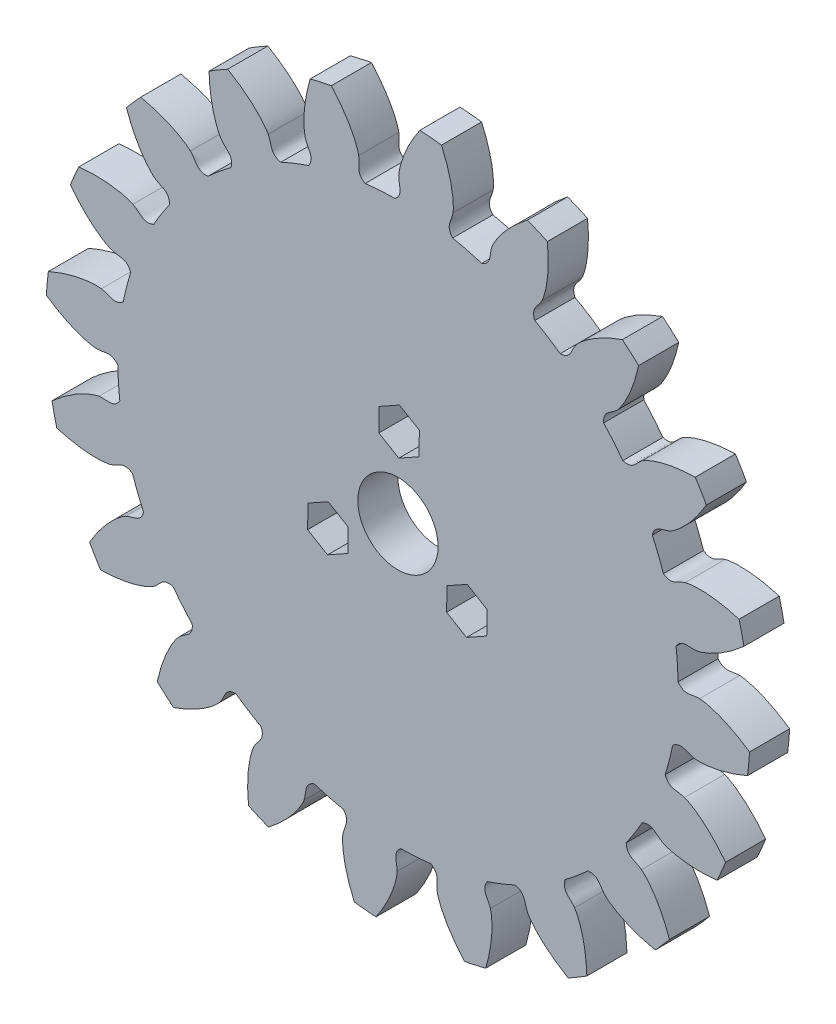
from build123d import *

# Parameters (mm, degrees)
EXTRUDE_1_DEPTH     = 5
SKETCH_4_R          = 5
CUT_EXTRUDE_1_DEPTH = 10
CUT_EXTRUDE_2_DEPTH = 30


with BuildPart() as part:
    # 草图3 → 凸台-拉伸1 (new body)
    with BuildSketch(Plane.XY):
        with BuildLine():
            ThreePointArc((-21.214390223, 38.433834658), (-22.388614953, 37.761884481), (-23.541576641, 37.054070873))
            add(Edge.make_bspline(
                [(-23.541576641, 37.054070873), (-23.510293487, 35.913117871), (-23.395194842, 34.774873193), (-23.047762199, 33.099059204), (-22.903178896, 32.548198428), (-22.628897046, 31.745215746), (-22.527778629, 31.481156662), (-22.355738569, 31.092635948), (-22.294977431, 30.964398059), (-22.163525568, 30.711612716), (-22.095368302, 30.586123676), (-22.011579578, 30.466444229)],
                knots=[0, 0, 0, 0, 0.5, 0.5, 0.75, 0.75, 0.875, 0.875, 0.9375, 0.9375, 1, 1, 1, 1], degree=3))
            add(Edge.make_bspline(
                [(-22.011579578, 30.466444229), (-21.871386265, 30.266199404), (-21.703478955, 30.091544269), (-21.355703543, 29.753277986), (-21.17540581, 29.589562165), (-20.953048582, 29.303224649), (-20.88681777, 29.199161973), (-20.787538017, 28.979202174), (-20.753612732, 28.860979271), (-20.721011052, 28.620539826), (-20.721620503, 28.499353877), (-20.747786174, 28.256747015), (-20.77422416, 28.138042918), (-20.805596249, 28.020299155)],
                knots=[0, 0, 0, 0, 0.25, 0.25, 0.5, 0.5, 0.625, 0.625, 0.75, 0.75, 0.875, 0.875, 1, 1, 1, 1], degree=3))
            ThreePointArc((-20.805596249, 28.020299155), (-22.275767015, 26.866339607), (-23.68205505, 25.635332426))
            add(Edge.make_bspline(
                [(-23.68205505, 25.635332426), (-23.923816165, 25.617383515), (-24.164783849, 25.623684882), (-24.513515182, 25.737971889), (-24.621640879, 25.791648864), (-24.821665001, 25.930148375), (-24.911422608, 26.013810336), (-25.152212173, 26.284428321), (-25.280891662, 26.493356946), (-25.549878805, 26.899462079), (-25.690836604, 27.097766645), (-25.862515312, 27.273506581)],
                knots=[0, 0, 0, 0, 0.25, 0.25, 0.375, 0.375, 0.5, 0.5, 0.75, 0.75, 1, 1, 1, 1], degree=3))
            add(Edge.make_bspline(
                [(-25.862515312, 27.273506581), (-25.963586321, 27.376968525), (-26.073835943, 27.467011005), (-26.297337789, 27.642706051), (-26.412058421, 27.726211751), (-26.762413586, 27.967674069), (-27.004186152, 28.116656661), (-27.747316911, 28.537561091), (-28.263534058, 28.781967196), (-29.316294105, 29.215192222), (-29.855285028, 29.404390106), (-30.944358277, 29.734711026), (-31.495636375, 29.876231737), (-32.052792123, 29.997141792)],
                knots=[0, 0, 0, 0, 0.0625, 0.0625, 0.125, 0.125, 0.25, 0.25, 0.5, 0.5, 0.75, 0.75, 1, 1, 1, 1], degree=3))
            ThreePointArc((-32.052792123, 29.997141792), (-32.961902182, 28.995223798), (-33.839707477, 27.965768297))
            add(Edge.make_bspline(
                [(-33.839707477, 27.965768297), (-33.457381562, 26.890324536), (-32.996179297, 25.843356957), (-32.147896216, 24.356925735), (-31.840163983, 23.877704703), (-31.331171147, 23.198780544), (-31.153403073, 22.978892742), (-30.86972375, 22.662550887), (-30.772308787, 22.559365632), (-30.569175669, 22.359573344), (-30.465576011, 22.261287928), (-30.348905217, 22.173358149)],
                knots=[0, 0, 0, 0, 0.5, 0.5, 0.75, 0.75, 0.875, 0.875, 0.9375, 0.9375, 1, 1, 1, 1], degree=3))
            add(Edge.make_bspline(
                [(-30.348905217, 22.173358149), (-30.153694398, 22.02623612), (-29.940033653, 21.912015429), (-29.504749551, 21.697773588), (-29.282685246, 21.597785653), (-28.982727796, 21.394174656), (-28.887581416, 21.315671615), (-28.725189444, 21.137156546), (-28.656391695, 21.035203373), (-28.551085779, 20.816606346), (-28.514216884, 20.701163328), (-28.464132273, 20.462344854), (-28.452594708, 20.341280763), (-28.446046514, 20.219605281)],
                knots=[0, 0, 0, 0, 0.25, 0.25, 0.5, 0.5, 0.625, 0.625, 0.75, 0.75, 0.875, 0.875, 1, 1, 1, 1], degree=3))
            ThreePointArc((-28.446046514, 20.219605281), (-29.48766889, 18.667816782), (-30.444726151, 17.062492479))
            add(Edge.make_bspline(
                [(-30.444726151, 17.062492479), (-30.669108116, 16.970713757), (-30.900229231, 16.902243604), (-31.267209065, 16.903173098), (-31.386629812, 16.920810257), (-31.619662759, 16.990720267), (-31.730880284, 17.042550894), (-32.043510325, 17.225515824), (-32.230454287, 17.384454605), (-32.61176965, 17.68756194), (-32.807107964, 17.832602434), (-33.024690745, 17.946689408)],
                knots=[0, 0, 0, 0, 0.25, 0.25, 0.375, 0.375, 0.5, 0.5, 0.75, 0.75, 1, 1, 1, 1], degree=3))
            add(Edge.make_bspline(
                [(-33.024690745, 17.946689408), (-33.152786486, 18.013854904), (-33.285464764, 18.065421384), (-33.552320405, 18.163451434), (-33.687230891, 18.20741945), (-34.095054413, 18.32879806), (-34.37103194, 18.395777093), (-35.207857913, 18.566440961), (-35.774335234, 18.639365109), (-36.909443433, 18.726065847), (-37.480519624, 18.739446372), (-38.618364612, 18.717058094), (-39.186393544, 18.681297987), (-39.75364341, 18.624119689)],
                knots=[0, 0, 0, 0, 0.0625, 0.0625, 0.125, 0.125, 0.25, 0.25, 0.5, 0.5, 0.75, 0.75, 1, 1, 1, 1], degree=3))
            ThreePointArc((-39.75364341, 18.624119689), (-40.308648769, 17.390308594), (-40.82537197, 16.139981477))
            add(Edge.make_bspline(
                [(-40.82537197, 16.139981477), (-40.129428019, 15.235318885), (-39.367267825, 14.382112885), (-38.101170165, 13.230566673), (-37.660411975, 12.869894877), (-36.96653192, 12.381487068), (-36.729515367, 12.227294697), (-36.361965289, 12.014097446), (-36.237432155, 11.946065317), (-35.982501868, 11.818823145), (-35.853600874, 11.757362214), (-35.715468559, 11.709789283)],
                knots=[0, 0, 0, 0, 0.5, 0.5, 0.75, 0.75, 0.875, 0.875, 0.9375, 0.9375, 1, 1, 1, 1], degree=3))
            add(Edge.make_bspline(
                [(-35.715468559, 11.709789283), (-35.484348831, 11.630191379), (-35.245849252, 11.587585848), (-34.765665101, 11.518339934), (-34.523571426, 11.491867401), (-34.17537568, 11.390913785), (-34.060627321, 11.345654805), (-33.851019188, 11.226058764), (-33.754083377, 11.150355209), (-33.586381304, 10.974998398), (-33.515643046, 10.87659868), (-33.394210783, 10.66494581), (-33.345827046, 10.55337232), (-33.301999552, 10.439675563)],
                knots=[0, 0, 0, 0, 0.25, 0.25, 0.5, 0.5, 0.625, 0.625, 0.75, 0.75, 0.875, 0.875, 1, 1, 1, 1], degree=3))
            ThreePointArc((-33.301999552, 10.439675563), (-33.813112282, 8.641957984), (-34.227255335, 6.819456887))
            add(Edge.make_bspline(
                [(-34.227255335, 6.819456887), (-34.41229408, 6.662832295), (-34.610944882, 6.526292957), (-34.960250674, 6.413773953), (-35.079276736, 6.393644848), (-35.322507619, 6.388122077), (-35.444298316, 6.403047828), (-35.798166427, 6.480449821), (-36.025075484, 6.573840724), (-36.481393262, 6.744280002), (-36.711991016, 6.821858851), (-36.954179351, 6.863125233)],
                knots=[0, 0, 0, 0, 0.25, 0.25, 0.375, 0.375, 0.5, 0.5, 0.75, 0.75, 1, 1, 1, 1], degree=3))
            add(Edge.make_bspline(
                [(-36.954179351, 6.863125233), (-37.09676092, 6.887419655), (-37.23888038, 6.895462449), (-37.522968128, 6.906231639), (-37.664862488, 6.906358074), (-38.09023376, 6.895771593), (-38.373401645, 6.874190693), (-39.222008475, 6.77790823), (-39.783295224, 6.672212096), (-40.889639274, 6.403901675), (-41.436899816, 6.240155062), (-42.512136348, 5.867249106), (-43.041313485, 5.65770863), (-43.563131101, 5.428038988)],
                knots=[0, 0, 0, 0, 0.0625, 0.0625, 0.125, 0.125, 0.25, 0.25, 0.5, 0.5, 0.75, 0.75, 1, 1, 1, 1], degree=3))
            ThreePointArc((-43.563131101, 5.428038988), (-43.709703968, 4.083108819), (-43.814764607, 2.734300816))
            add(Edge.make_bspline(
                [(-43.814764607, 2.734300816), (-42.873326463, 2.088974071), (-41.88481389, 1.513047397), (-40.324836111, 0.809107562), (-39.794196448, 0.602290072), (-38.983350987, 0.352207371), (-38.710286786, 0.278803855), (-38.294844316, 0.189620441), (-38.155383184, 0.163400895), (-37.87361008, 0.121164189), (-37.732025477, 0.102543968), (-37.585952995, 0.099984656)],
                knots=[0, 0, 0, 0, 0.5, 0.5, 0.75, 0.75, 0.875, 0.875, 0.9375, 0.9375, 1, 1, 1, 1], degree=3))
            add(Edge.make_bspline(
                [(-37.585952995, 0.099984656), (-37.341547966, 0.095702474), (-37.101555554, 0.128882629), (-36.623475124, 0.211410915), (-36.385049894, 0.261045099), (-36.022699678, 0.272630907), (-35.89958171, 0.265046253), (-35.66327532, 0.216076134), (-35.5476902, 0.174032587), (-35.334007816, 0.059081141), (-35.23632455, -0.012643229), (-35.055431271, -0.176412437), (-34.974937498, -0.267573734), (-34.898120844, -0.362162336)],
                knots=[0, 0, 0, 0, 0.25, 0.25, 0.5, 0.5, 0.625, 0.625, 0.75, 0.75, 0.875, 0.875, 1, 1, 1, 1], degree=3))
            ThreePointArc((-34.898120844, -0.362162336), (-34.828692654, -2.229835874), (-34.659382292, -4.09111466))
            add(Edge.make_bspline(
                [(-34.659382292, -4.09111466), (-34.786964935, -4.297253615), (-34.933700099, -4.488496716), (-35.231139364, -4.703450074), (-35.33811964, -4.759375066), (-35.567739327, -4.83979001), (-35.688181473, -4.863230172), (-36.048648577, -4.898967762), (-36.293311291, -4.880266491), (-36.779963921, -4.859179053), (-37.0232486, -4.856655808), (-37.266335408, -4.892249458)],
                knots=[0, 0, 0, 0, 0.25, 0.25, 0.375, 0.375, 0.5, 0.5, 0.75, 0.75, 1, 1, 1, 1], degree=3))
            add(Edge.make_bspline(
                [(-37.266335408, -4.892249458), (-37.409445927, -4.913204218), (-37.547094925, -4.949472393), (-37.820606293, -5.027018228), (-37.955594919, -5.07074575), (-38.356875637, -5.212261043), (-38.619515434, -5.320289387), (-39.396835571, -5.674093384), (-39.89798909, -5.948063524), (-40.867272328, -6.545121012), (-41.337147547, -6.869966103), (-42.24452398, -7.556887104), (-42.683049776, -7.919696667), (-43.108355997, -8.299375988)],
                knots=[0, 0, 0, 0, 0.0625, 0.0625, 0.125, 0.125, 0.25, 0.25, 0.5, 0.5, 0.75, 0.75, 1, 1, 1, 1], degree=3))
            ThreePointArc((-43.108355997, -8.299375988), (-42.832148799, -9.623774096), (-42.51526281, -10.93903226))
            add(Edge.make_bspline(
                [(-42.51526281, -10.93903226), (-41.420484996, -11.261854079), (-40.302382543, -11.504125712), (-38.601226139, -11.691552634), (-38.032647711, -11.724271083), (-37.184208046, -11.711548837), (-36.901825625, -11.696978251), (-36.479157166, -11.653417935), (-36.338419462, -11.635258345), (-36.057385455, -11.588355161), (-35.916976532, -11.562311995), (-35.777262475, -11.519607167)],
                knots=[0, 0, 0, 0, 0.5, 0.5, 0.75, 0.75, 0.875, 0.875, 0.9375, 0.9375, 1, 1, 1, 1], degree=3))
            add(Edge.make_bspline(
                [(-35.777262475, -11.519607167), (-35.543496213, -11.448154457), (-35.325503097, -11.34243652), (-34.896324232, -11.116212478), (-34.68490617, -10.995330116), (-34.343870847, -10.872338983), (-34.224434914, -10.841506874), (-33.984561583, -10.815057534), (-33.861641431, -10.819325557), (-33.622895457, -10.862619391), (-33.507829101, -10.900647531), (-33.285181901, -11.000502206), (-33.180457384, -11.062327808), (-33.078170919, -11.128549262)],
                knots=[0, 0, 0, 0, 0.25, 0.25, 0.5, 0.5, 0.625, 0.625, 0.75, 0.75, 0.875, 0.875, 1, 1, 1, 1], degree=3))
            ThreePointArc((-33.078170919, -11.128549262), (-32.434997923, -12.88335786), (-31.698807423, -14.601219399))
            add(Edge.make_bspline(
                [(-31.698807423, -14.601219399), (-31.756445288, -14.8366944), (-31.836901353, -15.063921057), (-32.053358664, -15.360267637), (-32.13782118, -15.446514188), (-32.331352894, -15.59394973), (-32.438656774, -15.653461319), (-32.77043784, -15.798840248), (-33.008904918, -15.856659218), (-33.47825545, -15.986987806), (-33.710412655, -16.059767158), (-33.930602905, -16.168736685)],
                knots=[0, 0, 0, 0, 0.25, 0.25, 0.375, 0.375, 0.5, 0.5, 0.75, 0.75, 1, 1, 1, 1], degree=3))
            add(Edge.make_bspline(
                [(-33.930602905, -16.168736685), (-34.06023372, -16.232889429), (-34.179938214, -16.309918393), (-34.416100001, -16.468188525), (-34.530969267, -16.551489649), (-34.868879278, -16.810081253), (-35.085281974, -16.993982474), (-35.715225908, -17.570675203), (-36.107189799, -17.986101244), (-36.844532028, -18.853461652), (-37.191027263, -19.30760712), (-37.841723269, -20.241302552), (-38.146671764, -20.721866874), (-38.433834655, -21.214390217)],
                knots=[0, 0, 0, 0, 0.0625, 0.0625, 0.125, 0.125, 0.25, 0.25, 0.5, 0.5, 0.75, 0.75, 1, 1, 1, 1], degree=3))
            ThreePointArc((-38.433834655, -21.214390217), (-37.761884476, -22.38861495), (-37.054070867, -23.541576641))
            add(Edge.make_bspline(
                [(-37.054070867, -23.541576641), (-35.913117865, -23.510293487), (-34.774873189, -23.395194842), (-33.099059202, -23.047762199), (-32.548198426, -22.903178896), (-31.745215744, -22.628897046), (-31.481156661, -22.527778629), (-31.092635947, -22.355738569), (-30.964398059, -22.29497743), (-30.711612716, -22.163525568), (-30.586123676, -22.095368302), (-30.466444229, -22.011579578)],
                knots=[0, 0, 0, 0, 0.5, 0.5, 0.75, 0.75, 0.875, 0.875, 0.9375, 0.9375, 1, 1, 1, 1], degree=3))
            add(Edge.make_bspline(
                [(-30.466444229, -22.011579578), (-30.266199404, -21.871386265), (-30.091544269, -21.703478955), (-29.753277986, -21.355703543), (-29.589562165, -21.17540581), (-29.303224649, -20.953048582), (-29.199161973, -20.88681777), (-28.979202174, -20.787538017), (-28.860979271, -20.753612732), (-28.620539826, -20.721011052), (-28.499353877, -20.721620503), (-28.256747015, -20.747786174), (-28.138042918, -20.77422416), (-28.020299155, -20.805596249)],
                knots=[0, 0, 0, 0, 0.25, 0.25, 0.5, 0.5, 0.625, 0.625, 0.75, 0.75, 0.875, 0.875, 1, 1, 1, 1], degree=3))
            ThreePointArc((-28.020299155, -20.805596249), (-26.866339607, -22.275767015), (-25.635332426, -23.68205505))
            add(Edge.make_bspline(
                [(-25.635332426, -23.68205505), (-25.617383515, -23.923816165), (-25.623684882, -24.164783849), (-25.737971889, -24.513515182), (-25.791648864, -24.621640879), (-25.930148375, -24.821665001), (-26.013810336, -24.911422608), (-26.284428321, -25.152212173), (-26.493356946, -25.280891662), (-26.899462079, -25.549878805), (-27.097766645, -25.690836604), (-27.273506581, -25.862515312)],
                knots=[0, 0, 0, 0, 0.25, 0.25, 0.375, 0.375, 0.5, 0.5, 0.75, 0.75, 1, 1, 1, 1], degree=3))
            add(Edge.make_bspline(
                [(-27.273506581, -25.862515312), (-27.376968525, -25.963586321), (-27.467011005, -26.073835943), (-27.642706051, -26.297337789), (-27.726211751, -26.412058421), (-27.967674069, -26.762413586), (-28.116656661, -27.004186152), (-28.537561091, -27.747316911), (-28.781967196, -28.263534058), (-29.215192222, -29.316294105), (-29.404390106, -29.855285028), (-29.734711026, -30.944358277), (-29.876231737, -31.495636375), (-29.997141792, -32.052792123)],
                knots=[0, 0, 0, 0, 0.0625, 0.0625, 0.125, 0.125, 0.25, 0.25, 0.5, 0.5, 0.75, 0.75, 1, 1, 1, 1], degree=3))
            ThreePointArc((-29.997141792, -32.052792123), (-28.995223798, -32.961902182), (-27.965768297, -33.839707477))
            add(Edge.make_bspline(
                [(-27.965768297, -33.839707477), (-26.890324536, -33.457381562), (-25.843356957, -32.996179297), (-24.356925735, -32.147896216), (-23.877704703, -31.840163983), (-23.198780544, -31.331171147), (-22.978892742, -31.153403073), (-22.662550887, -30.86972375), (-22.559365632, -30.772308787), (-22.359573344, -30.569175669), (-22.261287928, -30.465576011), (-22.173358149, -30.348905217)],
                knots=[0, 0, 0, 0, 0.5, 0.5, 0.75, 0.75, 0.875, 0.875, 0.9375, 0.9375, 1, 1, 1, 1], degree=3))
            add(Edge.make_bspline(
                [(-22.173358149, -30.348905217), (-22.02623612, -30.153694398), (-21.912015429, -29.940033653), (-21.697773588, -29.504749551), (-21.597785653, -29.282685246), (-21.394174656, -28.982727796), (-21.315671615, -28.887581416), (-21.137156546, -28.725189444), (-21.035203373, -28.656391695), (-20.816606346, -28.551085779), (-20.701163328, -28.514216884), (-20.462344854, -28.464132273), (-20.341280763, -28.452594708), (-20.219605281, -28.446046514)],
                knots=[0, 0, 0, 0, 0.25, 0.25, 0.5, 0.5, 0.625, 0.625, 0.75, 0.75, 0.875, 0.875, 1, 1, 1, 1], degree=3))
            ThreePointArc((-20.219605281, -28.446046514), (-18.667816782, -29.48766889), (-17.062492479, -30.444726151))
            add(Edge.make_bspline(
                [(-17.062492479, -30.444726151), (-16.970713757, -30.669108116), (-16.902243604, -30.900229231), (-16.903173098, -31.267209065), (-16.920810257, -31.386629812), (-16.990720267, -31.619662759), (-17.042550894, -31.730880284), (-17.225515824, -32.043510325), (-17.384454605, -32.230454287), (-17.68756194, -32.61176965), (-17.832602434, -32.807107964), (-17.946689408, -33.024690745)],
                knots=[0, 0, 0, 0, 0.25, 0.25, 0.375, 0.375, 0.5, 0.5, 0.75, 0.75, 1, 1, 1, 1], degree=3))
            add(Edge.make_bspline(
                [(-17.946689408, -33.024690745), (-18.013854904, -33.152786486), (-18.065421384, -33.285464764), (-18.163451434, -33.552320405), (-18.20741945, -33.687230891), (-18.32879806, -34.095054413), (-18.395777093, -34.37103194), (-18.566440961, -35.207857913), (-18.639365109, -35.774335234), (-18.726065847, -36.909443433), (-18.739446372, -37.480519624), (-18.717058094, -38.618364612), (-18.681297987, -39.186393544), (-18.624119689, -39.75364341)],
                knots=[0, 0, 0, 0, 0.0625, 0.0625, 0.125, 0.125, 0.25, 0.25, 0.5, 0.5, 0.75, 0.75, 1, 1, 1, 1], degree=3))
            ThreePointArc((-18.624119689, -39.75364341), (-17.390308594, -40.308648769), (-16.139981477, -40.82537197))
            add(Edge.make_bspline(
                [(-16.139981477, -40.82537197), (-15.235318885, -40.129428019), (-14.382112885, -39.367267825), (-13.230566673, -38.101170165), (-12.869894877, -37.660411975), (-12.381487068, -36.96653192), (-12.227294697, -36.729515367), (-12.014097446, -36.361965289), (-11.946065317, -36.237432155), (-11.818823145, -35.982501868), (-11.757362214, -35.853600874), (-11.709789283, -35.715468559)],
                knots=[0, 0, 0, 0, 0.5, 0.5, 0.75, 0.75, 0.875, 0.875, 0.9375, 0.9375, 1, 1, 1, 1], degree=3))
            add(Edge.make_bspline(
                [(-11.709789283, -35.715468559), (-11.630191379, -35.484348831), (-11.587585848, -35.245849252), (-11.518339934, -34.765665101), (-11.491867401, -34.523571426), (-11.390913785, -34.17537568), (-11.345654805, -34.060627321), (-11.226058764, -33.851019188), (-11.150355209, -33.754083377), (-10.974998398, -33.586381304), (-10.87659868, -33.515643046), (-10.66494581, -33.394210783), (-10.55337232, -33.345827046), (-10.439675563, -33.301999552)],
                knots=[0, 0, 0, 0, 0.25, 0.25, 0.5, 0.5, 0.625, 0.625, 0.75, 0.75, 0.875, 0.875, 1, 1, 1, 1], degree=3))
            ThreePointArc((-10.439675563, -33.301999552), (-8.641957984, -33.813112282), (-6.819456887, -34.227255335))
            add(Edge.make_bspline(
                [(-6.819456887, -34.227255335), (-6.662832295, -34.41229408), (-6.526292957, -34.610944882), (-6.413773953, -34.960250674), (-6.393644848, -35.079276736), (-6.388122077, -35.322507619), (-6.403047828, -35.444298316), (-6.480449821, -35.798166427), (-6.573840724, -36.025075484), (-6.744280002, -36.481393262), (-6.821858851, -36.711991016), (-6.863125233, -36.954179351)],
                knots=[0, 0, 0, 0, 0.25, 0.25, 0.375, 0.375, 0.5, 0.5, 0.75, 0.75, 1, 1, 1, 1], degree=3))
            add(Edge.make_bspline(
                [(-6.863125233, -36.954179351), (-6.887419655, -37.09676092), (-6.895462449, -37.23888038), (-6.906231639, -37.522968128), (-6.906358074, -37.664862488), (-6.895771593, -38.09023376), (-6.874190693, -38.373401645), (-6.77790823, -39.222008475), (-6.672212096, -39.783295224), (-6.403901675, -40.889639274), (-6.240155062, -41.436899816), (-5.867249106, -42.512136348), (-5.65770863, -43.041313485), (-5.428038988, -43.563131101)],
                knots=[0, 0, 0, 0, 0.0625, 0.0625, 0.125, 0.125, 0.25, 0.25, 0.5, 0.5, 0.75, 0.75, 1, 1, 1, 1], degree=3))
            ThreePointArc((-5.428038988, -43.563131101), (-4.083108819, -43.709703968), (-2.734300816, -43.814764607))
            add(Edge.make_bspline(
                [(-2.734300816, -43.814764607), (-2.088974071, -42.873326463), (-1.513047397, -41.88481389), (-0.809107562, -40.324836111), (-0.602290072, -39.794196448), (-0.352207371, -38.983350987), (-0.278803855, -38.710286786), (-0.189620441, -38.294844316), (-0.163400895, -38.155383184), (-0.121164189, -37.87361008), (-0.102543968, -37.732025477), (-0.099984656, -37.585952995)],
                knots=[0, 0, 0, 0, 0.5, 0.5, 0.75, 0.75, 0.875, 0.875, 0.9375, 0.9375, 1, 1, 1, 1], degree=3))
            add(Edge.make_bspline(
                [(-0.099984656, -37.585952995), (-0.095702474, -37.341547966), (-0.128882629, -37.101555554), (-0.211410915, -36.623475124), (-0.261045099, -36.385049894), (-0.272630907, -36.022699678), (-0.265046253, -35.89958171), (-0.216076134, -35.66327532), (-0.174032587, -35.5476902), (-0.059081141, -35.334007816), (0.012643229, -35.23632455), (0.176412437, -35.055431271), (0.267573735, -34.974937498), (0.362162336, -34.898120844)],
                knots=[0, 0, 0, 0, 0.25, 0.25, 0.5, 0.5, 0.625, 0.625, 0.75, 0.75, 0.875, 0.875, 1, 1, 1, 1], degree=3))
            ThreePointArc((0.362162336, -34.898120844), (2.229835874, -34.828692654), (4.09111466, -34.659382292))
            add(Edge.make_bspline(
                [(4.09111466, -34.659382292), (4.297253615, -34.786964935), (4.488496716, -34.933700099), (4.703450074, -35.231139364), (4.759375066, -35.33811964), (4.83979001, -35.567739327), (4.863230172, -35.688181473), (4.898967762, -36.048648577), (4.880266491, -36.293311291), (4.859179053, -36.779963921), (4.856655808, -37.0232486), (4.892249458, -37.266335408)],
                knots=[0, 0, 0, 0, 0.25, 0.25, 0.375, 0.375, 0.5, 0.5, 0.75, 0.75, 1, 1, 1, 1], degree=3))
            add(Edge.make_bspline(
                [(4.892249458, -37.266335408), (4.913204218, -37.409445927), (4.949472393, -37.547094925), (5.027018228, -37.820606293), (5.07074575, -37.955594919), (5.212261043, -38.356875637), (5.320289387, -38.619515434), (5.674093384, -39.396835571), (5.948063524, -39.89798909), (6.545121012, -40.867272328), (6.869966103, -41.337147547), (7.556887104, -42.24452398), (7.919696667, -42.683049776), (8.299375988, -43.108355997)],
                knots=[0, 0, 0, 0, 0.0625, 0.0625, 0.125, 0.125, 0.25, 0.25, 0.5, 0.5, 0.75, 0.75, 1, 1, 1, 1], degree=3))
            ThreePointArc((8.299375988, -43.108355997), (9.623774096, -42.832148799), (10.93903226, -42.51526281))
            add(Edge.make_bspline(
                [(10.93903226, -42.51526281), (11.261854079, -41.420484996), (11.504125712, -40.302382543), (11.691552634, -38.601226139), (11.724271083, -38.032647711), (11.711548837, -37.184208046), (11.696978251, -36.901825625), (11.653417935, -36.479157166), (11.635258345, -36.338419462), (11.588355161, -36.057385455), (11.562311995, -35.916976532), (11.519607167, -35.777262475)],
                knots=[0, 0, 0, 0, 0.5, 0.5, 0.75, 0.75, 0.875, 0.875, 0.9375, 0.9375, 1, 1, 1, 1], degree=3))
            add(Edge.make_bspline(
                [(11.519607167, -35.777262475), (11.448154457, -35.543496213), (11.34243652, -35.325503097), (11.116212478, -34.896324232), (10.995330116, -34.68490617), (10.872338983, -34.343870847), (10.841506874, -34.224434914), (10.815057534, -33.984561583), (10.819325557, -33.861641431), (10.862619391, -33.622895457), (10.900647531, -33.507829101), (11.000502206, -33.285181901), (11.062327808, -33.180457384), (11.128549262, -33.078170919)],
                knots=[0, 0, 0, 0, 0.25, 0.25, 0.5, 0.5, 0.625, 0.625, 0.75, 0.75, 0.875, 0.875, 1, 1, 1, 1], degree=3))
            ThreePointArc((11.128549262, -33.078170919), (12.88335786, -32.434997923), (14.601219399, -31.698807423))
            add(Edge.make_bspline(
                [(14.601219399, -31.698807423), (14.8366944, -31.756445288), (15.063921057, -31.836901353), (15.360267637, -32.053358664), (15.446514188, -32.13782118), (15.59394973, -32.331352894), (15.653461319, -32.438656774), (15.798840248, -32.77043784), (15.856659218, -33.008904918), (15.986987806, -33.47825545), (16.059767158, -33.710412655), (16.168736685, -33.930602905)],
                knots=[0, 0, 0, 0, 0.25, 0.25, 0.375, 0.375, 0.5, 0.5, 0.75, 0.75, 1, 1, 1, 1], degree=3))
            add(Edge.make_bspline(
                [(16.168736685, -33.930602905), (16.232889429, -34.06023372), (16.309918393, -34.179938214), (16.468188525, -34.416100001), (16.551489649, -34.530969267), (16.810081253, -34.868879278), (16.993982474, -35.085281974), (17.570675203, -35.715225908), (17.986101244, -36.107189799), (18.853461652, -36.844532028), (19.30760712, -37.191027263), (20.241302552, -37.841723269), (20.721866874, -38.146671764), (21.214390217, -38.433834655)],
                knots=[0, 0, 0, 0, 0.0625, 0.0625, 0.125, 0.125, 0.25, 0.25, 0.5, 0.5, 0.75, 0.75, 1, 1, 1, 1], degree=3))
            ThreePointArc((21.214390217, -38.433834655), (22.38861495, -37.761884476), (23.541576641, -37.054070867))
            add(Edge.make_bspline(
                [(23.541576641, -37.054070867), (23.510293487, -35.913117865), (23.395194842, -34.774873189), (23.047762199, -33.099059202), (22.903178896, -32.548198426), (22.628897046, -31.745215744), (22.527778629, -31.481156661), (22.355738569, -31.092635947), (22.29497743, -30.964398059), (22.163525568, -30.711612716), (22.095368302, -30.586123676), (22.011579578, -30.466444229)],
                knots=[0, 0, 0, 0, 0.5, 0.5, 0.75, 0.75, 0.875, 0.875, 0.9375, 0.9375, 1, 1, 1, 1], degree=3))
            add(Edge.make_bspline(
                [(22.011579578, -30.466444229), (21.871386265, -30.266199404), (21.703478955, -30.091544269), (21.355703543, -29.753277986), (21.17540581, -29.589562165), (20.953048582, -29.303224649), (20.88681777, -29.199161973), (20.787538017, -28.979202174), (20.753612732, -28.860979271), (20.721011052, -28.620539826), (20.721620503, -28.499353877), (20.747786174, -28.256747015), (20.77422416, -28.138042918), (20.805596249, -28.020299155)],
                knots=[0, 0, 0, 0, 0.25, 0.25, 0.5, 0.5, 0.625, 0.625, 0.75, 0.75, 0.875, 0.875, 1, 1, 1, 1], degree=3))
            ThreePointArc((20.805596249, -28.020299155), (22.275767015, -26.866339607), (23.68205505, -25.635332426))
            add(Edge.make_bspline(
                [(23.68205505, -25.635332426), (23.923816165, -25.617383515), (24.164783849, -25.623684882), (24.513515182, -25.737971889), (24.621640879, -25.791648864), (24.821665001, -25.930148375), (24.911422608, -26.013810336), (25.152212173, -26.284428321), (25.280891662, -26.493356946), (25.549878805, -26.899462079), (25.690836604, -27.097766645), (25.862515312, -27.273506581)],
                knots=[0, 0, 0, 0, 0.25, 0.25, 0.375, 0.375, 0.5, 0.5, 0.75, 0.75, 1, 1, 1, 1], degree=3))
            add(Edge.make_bspline(
                [(25.862515312, -27.273506581), (25.963586321, -27.376968525), (26.073835943, -27.467011005), (26.297337789, -27.642706051), (26.412058421, -27.726211751), (26.762413586, -27.967674069), (27.004186152, -28.116656661), (27.747316911, -28.537561091), (28.263534058, -28.781967196), (29.316294105, -29.215192222), (29.855285028, -29.404390106), (30.944358277, -29.734711026), (31.495636375, -29.876231737), (32.052792123, -29.997141792)],
                knots=[0, 0, 0, 0, 0.0625, 0.0625, 0.125, 0.125, 0.25, 0.25, 0.5, 0.5, 0.75, 0.75, 1, 1, 1, 1], degree=3))
            ThreePointArc((32.052792123, -29.997141792), (32.961902182, -28.995223798), (33.839707477, -27.965768297))
            add(Edge.make_bspline(
                [(33.839707477, -27.965768297), (33.457381562, -26.890324536), (32.996179297, -25.843356957), (32.147896216, -24.356925735), (31.840163983, -23.877704703), (31.331171147, -23.198780544), (31.153403073, -22.978892742), (30.86972375, -22.662550887), (30.772308787, -22.559365632), (30.569175669, -22.359573344), (30.465576011, -22.261287928), (30.348905217, -22.173358149)],
                knots=[0, 0, 0, 0, 0.5, 0.5, 0.75, 0.75, 0.875, 0.875, 0.9375, 0.9375, 1, 1, 1, 1], degree=3))
            add(Edge.make_bspline(
                [(30.348905217, -22.173358149), (30.153694398, -22.02623612), (29.940033653, -21.912015429), (29.504749551, -21.697773588), (29.282685246, -21.597785653), (28.982727796, -21.394174656), (28.887581416, -21.315671615), (28.725189444, -21.137156546), (28.656391695, -21.035203373), (28.551085779, -20.816606346), (28.514216884, -20.701163328), (28.464132273, -20.462344854), (28.452594708, -20.341280763), (28.446046514, -20.219605281)],
                knots=[0, 0, 0, 0, 0.25, 0.25, 0.5, 0.5, 0.625, 0.625, 0.75, 0.75, 0.875, 0.875, 1, 1, 1, 1], degree=3))
            ThreePointArc((28.446046514, -20.219605281), (29.48766889, -18.667816782), (30.444726151, -17.062492479))
            add(Edge.make_bspline(
                [(30.444726151, -17.062492479), (30.669108116, -16.970713757), (30.900229231, -16.902243604), (31.267209065, -16.903173098), (31.386629812, -16.920810257), (31.619662759, -16.990720267), (31.730880284, -17.042550894), (32.043510325, -17.225515824), (32.230454287, -17.384454605), (32.61176965, -17.68756194), (32.807107964, -17.832602434), (33.024690745, -17.946689408)],
                knots=[0, 0, 0, 0, 0.25, 0.25, 0.375, 0.375, 0.5, 0.5, 0.75, 0.75, 1, 1, 1, 1], degree=3))
            add(Edge.make_bspline(
                [(33.024690745, -17.946689408), (33.152786486, -18.013854904), (33.285464764, -18.065421384), (33.552320405, -18.163451434), (33.687230891, -18.20741945), (34.095054413, -18.32879806), (34.37103194, -18.395777093), (35.207857913, -18.566440961), (35.774335234, -18.639365109), (36.909443433, -18.726065847), (37.480519624, -18.739446372), (38.618364612, -18.717058094), (39.186393544, -18.681297987), (39.75364341, -18.624119689)],
                knots=[0, 0, 0, 0, 0.0625, 0.0625, 0.125, 0.125, 0.25, 0.25, 0.5, 0.5, 0.75, 0.75, 1, 1, 1, 1], degree=3))
            ThreePointArc((39.75364341, -18.624119689), (40.308648769, -17.390308594), (40.82537197, -16.139981477))
            add(Edge.make_bspline(
                [(40.82537197, -16.139981477), (40.129428019, -15.235318885), (39.367267825, -14.382112885), (38.101170165, -13.230566673), (37.660411975, -12.869894877), (36.96653192, -12.381487068), (36.729515367, -12.227294697), (36.361965289, -12.014097446), (36.237432155, -11.946065317), (35.982501868, -11.818823145), (35.853600874, -11.757362214), (35.715468559, -11.709789283)],
                knots=[0, 0, 0, 0, 0.5, 0.5, 0.75, 0.75, 0.875, 0.875, 0.9375, 0.9375, 1, 1, 1, 1], degree=3))
            add(Edge.make_bspline(
                [(35.715468559, -11.709789283), (35.484348831, -11.630191379), (35.245849252, -11.587585848), (34.765665101, -11.518339934), (34.523571426, -11.491867401), (34.17537568, -11.390913784), (34.060627321, -11.345654805), (33.851019188, -11.226058764), (33.754083377, -11.150355209), (33.586381304, -10.974998398), (33.515643046, -10.87659868), (33.394210783, -10.66494581), (33.345827046, -10.55337232), (33.301999552, -10.439675563)],
                knots=[0, 0, 0, 0, 0.25, 0.25, 0.5, 0.5, 0.625, 0.625, 0.75, 0.75, 0.875, 0.875, 1, 1, 1, 1], degree=3))
            ThreePointArc((33.301999552, -10.439675563), (33.813112282, -8.641957984), (34.227255335, -6.819456887))
            add(Edge.make_bspline(
                [(34.227255335, -6.819456887), (34.41229408, -6.662832295), (34.610944882, -6.526292957), (34.960250674, -6.413773953), (35.079276736, -6.393644848), (35.322507619, -6.388122077), (35.444298316, -6.403047828), (35.798166427, -6.480449821), (36.025075484, -6.573840724), (36.481393262, -6.744280002), (36.711991016, -6.821858851), (36.954179351, -6.863125233)],
                knots=[0, 0, 0, 0, 0.25, 0.25, 0.375, 0.375, 0.5, 0.5, 0.75, 0.75, 1, 1, 1, 1], degree=3))
            add(Edge.make_bspline(
                [(36.954179351, -6.863125233), (37.09676092, -6.887419655), (37.23888038, -6.895462449), (37.522968128, -6.906231639), (37.664862488, -6.906358074), (38.09023376, -6.895771593), (38.373401645, -6.874190693), (39.222008475, -6.77790823), (39.783295224, -6.672212096), (40.889639274, -6.403901675), (41.436899816, -6.240155062), (42.512136348, -5.867249106), (43.041313485, -5.65770863), (43.563131101, -5.428038988)],
                knots=[0, 0, 0, 0, 0.0625, 0.0625, 0.125, 0.125, 0.25, 0.25, 0.5, 0.5, 0.75, 0.75, 1, 1, 1, 1], degree=3))
            ThreePointArc((43.563131101, -5.428038988), (43.709703968, -4.083108819), (43.814764607, -2.734300816))
            add(Edge.make_bspline(
                [(43.814764607, -2.734300816), (42.873326463, -2.088974071), (41.88481389, -1.513047397), (40.324836111, -0.809107562), (39.794196448, -0.602290072), (38.983350987, -0.352207371), (38.710286786, -0.278803855), (38.294844316, -0.189620441), (38.155383184, -0.163400895), (37.87361008, -0.121164189), (37.732025477, -0.102543968), (37.585952995, -0.099984656)],
                knots=[0, 0, 0, 0, 0.5, 0.5, 0.75, 0.75, 0.875, 0.875, 0.9375, 0.9375, 1, 1, 1, 1], degree=3))
            add(Edge.make_bspline(
                [(37.585952995, -0.099984656), (37.341547966, -0.095702474), (37.101555554, -0.128882629), (36.623475124, -0.211410915), (36.385049894, -0.261045099), (36.022699678, -0.272630907), (35.89958171, -0.265046253), (35.66327532, -0.216076134), (35.5476902, -0.174032587), (35.334007816, -0.059081141), (35.23632455, 0.012643229), (35.055431271, 0.176412437), (34.974937498, 0.267573735), (34.898120844, 0.362162336)],
                knots=[0, 0, 0, 0, 0.25, 0.25, 0.5, 0.5, 0.625, 0.625, 0.75, 0.75, 0.875, 0.875, 1, 1, 1, 1], degree=3))
            ThreePointArc((34.898120844, 0.362162336), (34.828692654, 2.229835874), (34.659382292, 4.09111466))
            add(Edge.make_bspline(
                [(34.659382292, 4.09111466), (34.786964935, 4.297253615), (34.933700099, 4.488496716), (35.231139364, 4.703450074), (35.33811964, 4.759375066), (35.567739327, 4.83979001), (35.688181473, 4.863230172), (36.048648577, 4.898967762), (36.293311291, 4.880266491), (36.779963921, 4.859179053), (37.0232486, 4.856655808), (37.266335408, 4.892249458)],
                knots=[0, 0, 0, 0, 0.25, 0.25, 0.375, 0.375, 0.5, 0.5, 0.75, 0.75, 1, 1, 1, 1], degree=3))
            add(Edge.make_bspline(
                [(37.266335408, 4.892249458), (37.409445927, 4.913204218), (37.547094925, 4.949472393), (37.820606293, 5.027018228), (37.955594919, 5.07074575), (38.356875637, 5.212261043), (38.619515434, 5.320289387), (39.396835571, 5.674093384), (39.89798909, 5.948063524), (40.867272328, 6.545121012), (41.337147547, 6.869966103), (42.24452398, 7.556887104), (42.683049776, 7.919696667), (43.108355997, 8.299375988)],
                knots=[0, 0, 0, 0, 0.0625, 0.0625, 0.125, 0.125, 0.25, 0.25, 0.5, 0.5, 0.75, 0.75, 1, 1, 1, 1], degree=3))
            ThreePointArc((43.108355997, 8.299375988), (42.832148799, 9.623774096), (42.51526281, 10.93903226))
            add(Edge.make_bspline(
                [(42.51526281, 10.93903226), (41.420484996, 11.261854079), (40.302382543, 11.504125712), (38.601226139, 11.691552634), (38.032647711, 11.724271083), (37.184208046, 11.711548837), (36.901825625, 11.696978251), (36.479157166, 11.653417935), (36.338419462, 11.635258345), (36.057385455, 11.588355161), (35.916976532, 11.562311995), (35.777262475, 11.519607167)],
                knots=[0, 0, 0, 0, 0.5, 0.5, 0.75, 0.75, 0.875, 0.875, 0.9375, 0.9375, 1, 1, 1, 1], degree=3))
            add(Edge.make_bspline(
                [(35.777262475, 11.519607167), (35.543496213, 11.448154457), (35.325503097, 11.34243652), (34.896324232, 11.116212478), (34.68490617, 10.995330116), (34.343870847, 10.872338983), (34.224434914, 10.841506874), (33.984561583, 10.815057534), (33.861641431, 10.819325557), (33.622895457, 10.862619391), (33.507829101, 10.900647531), (33.285181901, 11.000502206), (33.180457384, 11.062327808), (33.078170919, 11.128549262)],
                knots=[0, 0, 0, 0, 0.25, 0.25, 0.5, 0.5, 0.625, 0.625, 0.75, 0.75, 0.875, 0.875, 1, 1, 1, 1], degree=3))
            ThreePointArc((33.078170919, 11.128549262), (32.434997923, 12.88335786), (31.698807423, 14.601219399))
            add(Edge.make_bspline(
                [(31.698807423, 14.601219399), (31.756445288, 14.8366944), (31.836901353, 15.063921057), (32.053358664, 15.360267637), (32.13782118, 15.446514188), (32.331352894, 15.59394973), (32.438656774, 15.653461319), (32.77043784, 15.798840248), (33.008904918, 15.856659218), (33.47825545, 15.986987806), (33.710412655, 16.059767158), (33.930602905, 16.168736685)],
                knots=[0, 0, 0, 0, 0.25, 0.25, 0.375, 0.375, 0.5, 0.5, 0.75, 0.75, 1, 1, 1, 1], degree=3))
            add(Edge.make_bspline(
                [(33.930602905, 16.168736685), (34.06023372, 16.232889429), (34.179938214, 16.309918393), (34.416100001, 16.468188525), (34.530969267, 16.551489649), (34.868879278, 16.810081253), (35.085281974, 16.993982474), (35.715225908, 17.570675203), (36.107189799, 17.986101244), (36.844532028, 18.853461652), (37.191027263, 19.30760712), (37.841723269, 20.241302552), (38.146671764, 20.721866874), (38.433834655, 21.214390217)],
                knots=[0, 0, 0, 0, 0.0625, 0.0625, 0.125, 0.125, 0.25, 0.25, 0.5, 0.5, 0.75, 0.75, 1, 1, 1, 1], degree=3))
            ThreePointArc((38.433834655, 21.214390217), (37.761884476, 22.38861495), (37.054070867, 23.541576641))
            add(Edge.make_bspline(
                [(37.054070867, 23.541576641), (35.913117865, 23.510293487), (34.774873189, 23.395194842), (33.099059202, 23.047762199), (32.548198426, 22.903178896), (31.745215744, 22.628897046), (31.481156661, 22.527778629), (31.092635947, 22.355738569), (30.964398059, 22.29497743), (30.711612716, 22.163525568), (30.586123676, 22.095368302), (30.466444229, 22.011579578)],
                knots=[0, 0, 0, 0, 0.5, 0.5, 0.75, 0.75, 0.875, 0.875, 0.9375, 0.9375, 1, 1, 1, 1], degree=3))
            add(Edge.make_bspline(
                [(30.466444229, 22.011579578), (30.266199404, 21.871386265), (30.091544269, 21.703478955), (29.753277986, 21.355703543), (29.589562165, 21.17540581), (29.303224649, 20.953048582), (29.199161973, 20.88681777), (28.979202174, 20.787538017), (28.860979271, 20.753612732), (28.620539826, 20.721011052), (28.499353877, 20.721620503), (28.256747015, 20.747786174), (28.138042918, 20.77422416), (28.020299155, 20.805596249)],
                knots=[0, 0, 0, 0, 0.25, 0.25, 0.5, 0.5, 0.625, 0.625, 0.75, 0.75, 0.875, 0.875, 1, 1, 1, 1], degree=3))
            ThreePointArc((28.020299155, 20.805596249), (26.866339607, 22.275767015), (25.635332426, 23.68205505))
            add(Edge.make_bspline(
                [(25.635332426, 23.68205505), (25.617383515, 23.923816165), (25.623684882, 24.164783849), (25.737971889, 24.513515182), (25.791648864, 24.621640879), (25.930148375, 24.821665001), (26.013810336, 24.911422608), (26.284428321, 25.152212173), (26.493356946, 25.280891662), (26.899462079, 25.549878805), (27.097766645, 25.690836604), (27.273506581, 25.862515312)],
                knots=[0, 0, 0, 0, 0.25, 0.25, 0.375, 0.375, 0.5, 0.5, 0.75, 0.75, 1, 1, 1, 1], degree=3))
            add(Edge.make_bspline(
                [(27.273506581, 25.862515312), (27.376968525, 25.963586321), (27.467011005, 26.073835943), (27.642706051, 26.297337789), (27.726211751, 26.412058421), (27.967674069, 26.762413586), (28.116656661, 27.004186152), (28.537561091, 27.747316911), (28.781967196, 28.263534058), (29.215192222, 29.316294105), (29.404390106, 29.855285028), (29.734711026, 30.944358277), (29.876231737, 31.495636375), (29.997141792, 32.052792123)],
                knots=[0, 0, 0, 0, 0.0625, 0.0625, 0.125, 0.125, 0.25, 0.25, 0.5, 0.5, 0.75, 0.75, 1, 1, 1, 1], degree=3))
            ThreePointArc((29.997141792, 32.052792123), (28.995223798, 32.961902182), (27.965768297, 33.839707477))
            add(Edge.make_bspline(
                [(27.965768297, 33.839707477), (26.890324536, 33.457381562), (25.843356957, 32.996179297), (24.356925735, 32.147896216), (23.877704703, 31.840163983), (23.198780544, 31.331171147), (22.978892742, 31.153403073), (22.662550887, 30.86972375), (22.559365632, 30.772308787), (22.359573344, 30.569175669), (22.261287928, 30.465576011), (22.173358149, 30.348905217)],
                knots=[0, 0, 0, 0, 0.5, 0.5, 0.75, 0.75, 0.875, 0.875, 0.9375, 0.9375, 1, 1, 1, 1], degree=3))
            add(Edge.make_bspline(
                [(22.173358149, 30.348905217), (22.02623612, 30.153694398), (21.912015429, 29.940033653), (21.697773588, 29.504749551), (21.597785653, 29.282685246), (21.394174656, 28.982727796), (21.315671615, 28.887581416), (21.137156546, 28.725189444), (21.035203373, 28.656391695), (20.816606346, 28.551085779), (20.701163328, 28.514216884), (20.462344854, 28.464132273), (20.341280763, 28.452594708), (20.219605281, 28.446046514)],
                knots=[0, 0, 0, 0, 0.25, 0.25, 0.5, 0.5, 0.625, 0.625, 0.75, 0.75, 0.875, 0.875, 1, 1, 1, 1], degree=3))
            ThreePointArc((20.219605281, 28.446046514), (18.667816782, 29.48766889), (17.062492479, 30.444726151))
            add(Edge.make_bspline(
                [(17.062492479, 30.444726151), (16.970713757, 30.669108116), (16.902243604, 30.900229231), (16.903173098, 31.267209065), (16.920810257, 31.386629812), (16.990720267, 31.619662759), (17.042550894, 31.730880284), (17.225515824, 32.043510325), (17.384454605, 32.230454287), (17.68756194, 32.61176965), (17.832602434, 32.807107964), (17.946689408, 33.024690745)],
                knots=[0, 0, 0, 0, 0.25, 0.25, 0.375, 0.375, 0.5, 0.5, 0.75, 0.75, 1, 1, 1, 1], degree=3))
            add(Edge.make_bspline(
                [(17.946689408, 33.024690745), (18.013854904, 33.152786486), (18.065421384, 33.285464764), (18.163451434, 33.552320405), (18.20741945, 33.687230891), (18.32879806, 34.095054413), (18.395777093, 34.37103194), (18.566440961, 35.207857913), (18.639365109, 35.774335234), (18.726065847, 36.909443433), (18.739446372, 37.480519624), (18.717058094, 38.618364612), (18.681297987, 39.186393544), (18.624119689, 39.75364341)],
                knots=[0, 0, 0, 0, 0.0625, 0.0625, 0.125, 0.125, 0.25, 0.25, 0.5, 0.5, 0.75, 0.75, 1, 1, 1, 1], degree=3))
            ThreePointArc((18.624119689, 39.75364341), (17.390308594, 40.308648769), (16.139981477, 40.82537197))
            add(Edge.make_bspline(
                [(16.139981477, 40.82537197), (15.235318885, 40.129428019), (14.382112885, 39.367267825), (13.230566673, 38.101170165), (12.869894877, 37.660411975), (12.381487068, 36.96653192), (12.227294697, 36.729515367), (12.014097446, 36.361965289), (11.946065317, 36.237432155), (11.818823145, 35.982501868), (11.757362214, 35.853600874), (11.709789283, 35.715468559)],
                knots=[0, 0, 0, 0, 0.5, 0.5, 0.75, 0.75, 0.875, 0.875, 0.9375, 0.9375, 1, 1, 1, 1], degree=3))
            add(Edge.make_bspline(
                [(11.709789283, 35.715468559), (11.630191379, 35.484348831), (11.587585848, 35.245849252), (11.518339934, 34.765665101), (11.491867401, 34.523571426), (11.390913784, 34.17537568), (11.345654805, 34.060627321), (11.226058764, 33.851019188), (11.150355209, 33.754083377), (10.974998398, 33.586381304), (10.87659868, 33.515643046), (10.66494581, 33.394210783), (10.55337232, 33.345827046), (10.439675563, 33.301999552)],
                knots=[0, 0, 0, 0, 0.25, 0.25, 0.5, 0.5, 0.625, 0.625, 0.75, 0.75, 0.875, 0.875, 1, 1, 1, 1], degree=3))
            ThreePointArc((10.439675563, 33.301999552), (8.641957984, 33.813112282), (6.819456887, 34.227255335))
            add(Edge.make_bspline(
                [(6.819456887, 34.227255335), (6.662832295, 34.41229408), (6.526292957, 34.610944882), (6.413773953, 34.960250674), (6.393644848, 35.079276736), (6.388122077, 35.322507619), (6.403047828, 35.444298316), (6.480449821, 35.798166427), (6.573840724, 36.025075484), (6.744280002, 36.481393262), (6.821858851, 36.711991016), (6.863125233, 36.954179351)],
                knots=[0, 0, 0, 0, 0.25, 0.25, 0.375, 0.375, 0.5, 0.5, 0.75, 0.75, 1, 1, 1, 1], degree=3))
            add(Edge.make_bspline(
                [(6.863125233, 36.954179351), (6.887419655, 37.09676092), (6.895462449, 37.23888038), (6.906231639, 37.522968128), (6.906358074, 37.664862488), (6.895771593, 38.09023376), (6.874190693, 38.373401645), (6.77790823, 39.222008475), (6.672212096, 39.783295224), (6.403901675, 40.889639274), (6.240155062, 41.436899816), (5.867249106, 42.512136348), (5.65770863, 43.041313485), (5.428038988, 43.563131101)],
                knots=[0, 0, 0, 0, 0.0625, 0.0625, 0.125, 0.125, 0.25, 0.25, 0.5, 0.5, 0.75, 0.75, 1, 1, 1, 1], degree=3))
            ThreePointArc((5.428038988, 43.563131101), (4.083108819, 43.709703968), (2.734300816, 43.814764607))
            add(Edge.make_bspline(
                [(2.734300816, 43.814764607), (2.088974071, 42.873326463), (1.513047397, 41.88481389), (0.809107562, 40.324836111), (0.602290072, 39.794196448), (0.352207371, 38.983350987), (0.278803855, 38.710286786), (0.189620441, 38.294844316), (0.163400895, 38.155383184), (0.121164189, 37.87361008), (0.102543968, 37.732025477), (0.099984655, 37.585952995)],
                knots=[0, 0, 0, 0, 0.5, 0.5, 0.75, 0.75, 0.875, 0.875, 0.9375, 0.9375, 1, 1, 1, 1], degree=3))
            add(Edge.make_bspline(
                [(0.099984655, 37.585952995), (0.095702474, 37.341547966), (0.128882629, 37.101555554), (0.211410915, 36.623475124), (0.261045099, 36.385049894), (0.272630907, 36.022699678), (0.265046253, 35.89958171), (0.216076134, 35.66327532), (0.174032587, 35.5476902), (0.059081141, 35.334007816), (-0.012643229, 35.23632455), (-0.176412437, 35.055431271), (-0.267573734, 34.974937498), (-0.362162336, 34.898120844)],
                knots=[0, 0, 0, 0, 0.25, 0.25, 0.5, 0.5, 0.625, 0.625, 0.75, 0.75, 0.875, 0.875, 1, 1, 1, 1], degree=3))
            ThreePointArc((-0.362162336, 34.898120844), (-2.229835874, 34.828692654), (-4.09111466, 34.659382292))
            add(Edge.make_bspline(
                [(-4.09111466, 34.659382292), (-4.297253615, 34.786964935), (-4.488496716, 34.933700099), (-4.703450074, 35.231139364), (-4.759375066, 35.33811964), (-4.83979001, 35.567739327), (-4.863230172, 35.688181473), (-4.898967762, 36.048648577), (-4.880266491, 36.293311291), (-4.859179053, 36.779963921), (-4.856655808, 37.0232486), (-4.892249458, 37.266335408)],
                knots=[0, 0, 0, 0, 0.25, 0.25, 0.375, 0.375, 0.5, 0.5, 0.75, 0.75, 1, 1, 1, 1], degree=3))
            add(Edge.make_bspline(
                [(-4.892249458, 37.266335408), (-4.913204218, 37.409445927), (-4.949472393, 37.547094925), (-5.027018228, 37.820606293), (-5.07074575, 37.955594919), (-5.212261043, 38.356875637), (-5.320289387, 38.619515434), (-5.674093384, 39.396835571), (-5.948063524, 39.89798909), (-6.545121012, 40.867272328), (-6.869966103, 41.337147547), (-7.556887104, 42.24452398), (-7.919696667, 42.683049776), (-8.299375988, 43.108355997)],
                knots=[0, 0, 0, 0, 0.0625, 0.0625, 0.125, 0.125, 0.25, 0.25, 0.5, 0.5, 0.75, 0.75, 1, 1, 1, 1], degree=3))
            ThreePointArc((-8.299375988, 43.108355997), (-9.623774096, 42.832148799), (-10.93903226, 42.51526281))
            add(Edge.make_bspline(
                [(-10.93903226, 42.51526281), (-11.261854079, 41.420484996), (-11.504125712, 40.302382543), (-11.691552634, 38.601226139), (-11.724271083, 38.032647711), (-11.711548837, 37.184208046), (-11.696978251, 36.901825625), (-11.653417935, 36.479157166), (-11.635258345, 36.338419462), (-11.588355161, 36.057385455), (-11.562311995, 35.916976532), (-11.519607167, 35.777262475)],
                knots=[0, 0, 0, 0, 0.5, 0.5, 0.75, 0.75, 0.875, 0.875, 0.9375, 0.9375, 1, 1, 1, 1], degree=3))
            add(Edge.make_bspline(
                [(-11.519607167, 35.777262475), (-11.448154457, 35.543496213), (-11.34243652, 35.325503097), (-11.116212478, 34.896324232), (-10.995330116, 34.68490617), (-10.872338983, 34.343870847), (-10.841506874, 34.224434914), (-10.815057534, 33.984561583), (-10.819325557, 33.861641431), (-10.862619391, 33.622895457), (-10.900647531, 33.507829101), (-11.000502206, 33.285181901), (-11.062327808, 33.180457384), (-11.128549262, 33.078170919)],
                knots=[0, 0, 0, 0, 0.25, 0.25, 0.5, 0.5, 0.625, 0.625, 0.75, 0.75, 0.875, 0.875, 1, 1, 1, 1], degree=3))
            ThreePointArc((-11.128549262, 33.078170919), (-12.88335786, 32.434997923), (-14.601219399, 31.698807423))
            add(Edge.make_bspline(
                [(-14.601219399, 31.698807423), (-14.8366944, 31.756445288), (-15.063921057, 31.836901353), (-15.360267637, 32.053358664), (-15.446514188, 32.13782118), (-15.59394973, 32.331352894), (-15.653461319, 32.438656774), (-15.798840248, 32.77043784), (-15.856659218, 33.008904918), (-15.986987806, 33.47825545), (-16.059767158, 33.710412655), (-16.168736685, 33.930602905)],
                knots=[0, 0, 0, 0, 0.25, 0.25, 0.375, 0.375, 0.5, 0.5, 0.75, 0.75, 1, 1, 1, 1], degree=3))
            add(Edge.make_bspline(
                [(-16.168736685, 33.930602905), (-16.232889429, 34.06023372), (-16.309918394, 34.179938214), (-16.468188525, 34.416100002), (-16.55148965, 34.530969267), (-16.810081253, 34.868879278), (-16.993982474, 35.085281975), (-17.570675204, 35.71522591), (-17.986101246, 36.107189801), (-18.853461655, 36.844532031), (-19.307607123, 37.191027266), (-20.241302557, 37.841723272), (-20.721866879, 38.146671767), (-21.214390223, 38.433834658)],
                knots=[0, 0, 0, 0, 0.0625, 0.0625, 0.125, 0.125, 0.25, 0.25, 0.5, 0.5, 0.75, 0.75, 1, 1, 1, 1], degree=3))
        make_face()
    extrude(amount=EXTRUDE_1_DEPTH)

    # 草图4 → 切除-拉伸1 (cut)
    with BuildSketch(Plane.XY.offset(5)):
        Circle(SKETCH_4_R)
    extrude(amount=-CUT_EXTRUDE_1_DEPTH, mode=Mode.SUBTRACT)

    # 草图5 → 切除-拉伸2 (cut)
    with BuildSketch(Plane(origin=(0, 0, 0), x_dir=(-1, 0, 0), z_dir=(0, 0, -1))):
        Polygon((-0.103894624, 7.113556492), (2.374760297, 8.59328725), (2.33260333, 11.479730758), (-0.188208558, 12.886443508), (-2.666863479, 11.40671275), (-2.624706512, 8.520269242), align=None)
        Polygon((6.212467946, -3.466802862), (6.254624912, -6.35324637), (8.7754368, -7.75995912), (11.254091721, -6.280228362), (11.211934754, -3.393784854), (8.691122867, -1.987072104), align=None)
        Polygon((-6.108573321, -3.64675363), (-8.629385209, -2.24004088), (-11.10804013, -3.719771638), (-11.065883163, -6.606215146), (-8.545071276, -8.012927896), (-6.066416355, -6.533197138), align=None)
    extrude(amount=-CUT_EXTRUDE_2_DEPTH, mode=Mode.SUBTRACT)


solid = part.part
